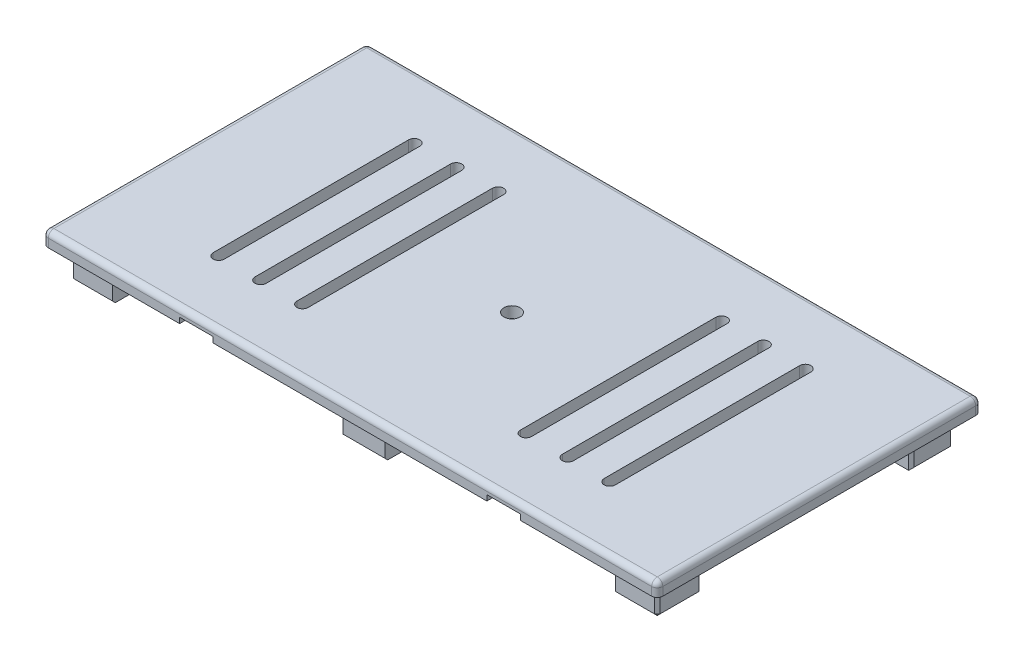
from build123d import *

# Parameters (mm, degrees)
SKETCH1_W           = 110
SKETCH1_H           = 58
BOSS_EXTRUDE1_DEPTH = 2.5
SKETCH2_W           = 105
SKETCH2_H           = 53
BOSS_EXTRUDE2_DEPTH = 1.5
SKETCH3_W           = 7.5
SKETCH3_H           = 3
BOSS_EXTRUDE3_DEPTH = 4
FILLET1_R           = 1
SKETCH4_W           = 6
SKETCH4_H           = 2.5
CUT_EXTRUDE1_DEPTH  = 1
FILLET2_R           = 1
CHAMFER1_SIZE       = 0.5
CUT_EXTRUDE2_DEPTH  = 125.611395948
FILLET3_R           = 1
SKETCH6_R           = 1.45
CUT_EXTRUDE3_DEPTH  = 125.611395948
SKETCH7_R           = 1.675
CUT_EXTRUDE4_DEPTH  = 2


with BuildPart() as part:
    # Sketch1 → Boss-Extrude1 (new body)
    with BuildSketch(Plane(origin=(0, 0, 0), x_dir=(1, 0, 0), z_dir=(0, 1, 0))):
        with Locations((55, 29)):
            Rectangle(SKETCH1_W, SKETCH1_H)
    extrude(amount=BOSS_EXTRUDE1_DEPTH)

    # Sketch2 → Boss-Extrude2 (add)
    with BuildSketch(Plane.XZ):
        with Locations((55, -29)):
            Rectangle(SKETCH2_W, SKETCH2_H)
    extrude(amount=BOSS_EXTRUDE2_DEPTH)

    # Sketch3 → Boss-Extrude3 (add)
    with BuildSketch(Plane.XZ.offset(1.5)):
        with Locations((55, -4)):
            Rectangle(SKETCH3_W, SKETCH3_H)
        Polygon((2.5, -2.5), (10, -2.5), (10, -5.5), (5.5, -5.5), (5.5, -10), (2.5, -10), align=None)
        Polygon((107.5, -2.5), (107.5, -10), (104.5, -10), (104.5, -5.5), (100, -5.5), (100, -2.5), align=None)
        Polygon((107.5, -55.5), (100, -55.5), (100, -52.5), (104.5, -52.5), (104.5, -48), (107.5, -48), align=None)
        with Locations((55, -54)):
            Rectangle(SKETCH3_W, SKETCH3_H)
        Polygon((2.5, -55.5), (2.5, -48), (5.5, -48), (5.5, -52.5), (10, -52.5), (10, -55.5), align=None)
    extrude(amount=BOSS_EXTRUDE3_DEPTH)

    # Fillet1
    fillet1_edges = [part.edges().sort_by_distance(p)[0] for p in [
        (104.5, -3.5, -52.5),
        (5.5, -3.5, -5.5),
        (104.5, -3.5, -5.5),
        (5.5, -3.5, -52.5),
    ]]
    fillet(fillet1_edges, radius=FILLET1_R)

    # Sketch4 → Cut-Extrude1 (cut)
    with BuildSketch(Plane.XZ):
        with Locations((27.5, -1.25)):
            Rectangle(SKETCH4_W, SKETCH4_H)
        with Locations((82.5, -1.25)):
            Rectangle(SKETCH4_W, SKETCH4_H)
        with Locations((82.5, -56.75)):
            Rectangle(SKETCH4_W, SKETCH4_H)
        with Locations((27.5, -56.75)):
            Rectangle(SKETCH4_W, SKETCH4_H)
    extrude(amount=-CUT_EXTRUDE1_DEPTH, mode=Mode.SUBTRACT)

    # Fillet2
    fillet2_edges = [part.edges().sort_by_distance(p)[0] for p in [
        (0, 1.25, -58),
        (110, 1.25, -58),
        (110, 1.25, 0),
        (0, 1.25, 0),
    ]]
    fillet(fillet2_edges, radius=FILLET2_R)

    # Chamfer1
    chamfer1_edges = [part.edges().sort_by_distance(p)[0] for p in [
        (2.5, -2.75, -2.5),
        (2.5, -2.75, -55.5),
        (107.5, -2.75, -55.5),
        (107.5, -2.75, -2.5),
        (107.5, -3.5, -48),
        (100, -3.5, -55.5),
        (107.5, -5.5, -51.75),
        (103.75, -5.5, -55.5),
        (2.5, -5.5, -6.25),
        (6.25, -5.5, -2.5),
        (55, -5.5, -2.5),
        (103.75, -5.5, -2.5),
        (107.5, -5.5, -6.25),
        (55, -5.5, -55.5),
        (6.25, -5.5, -55.5),
        (2.5, -5.5, -51.75),
    ]]
    chamfer(chamfer1_edges, length=CHAMFER1_SIZE)

    # Sketch5 → Cut-Extrude2 (cut, through all)
    with BuildSketch(Plane(origin=(0, 2.5, 0), x_dir=(1, 0, 0), z_dir=(0, 1, 0))):
        with BuildLine():
            Line((28.5, 46.5), (28.5, 11.5))
            ThreePointArc((28.5, 11.5), (27.5, 10.5), (26.5, 11.5))
            Line((26.5, 11.5), (26.5, 46.5))
            ThreePointArc((26.5, 46.5), (27.5, 47.5), (28.5, 46.5))
        make_face()
        with BuildLine():
            Line((34, 46.5), (34, 11.5))
            ThreePointArc((34, 11.5), (35, 10.5), (36, 11.5))
            Line((36, 11.5), (36, 46.5))
            ThreePointArc((36, 46.5), (35, 47.5), (34, 46.5))
        make_face()
        with BuildLine():
            Line((21, 46.5), (21, 11.5))
            ThreePointArc((21, 11.5), (20, 10.5), (19, 11.5))
            Line((19, 11.5), (19, 46.5))
            ThreePointArc((19, 46.5), (20, 47.5), (21, 46.5))
        make_face()
        with BuildLine():
            Line((89, 46.5), (89, 11.5))
            ThreePointArc((89, 11.5), (90, 10.5), (91, 11.5))
            Line((91, 11.5), (91, 46.5))
            ThreePointArc((91, 46.5), (90, 47.5), (89, 46.5))
        make_face()
        with BuildLine():
            Line((74, 46.5), (74, 11.5))
            ThreePointArc((74, 11.5), (75, 10.5), (76, 11.5))
            Line((76, 11.5), (76, 46.5))
            ThreePointArc((76, 46.5), (75, 47.5), (74, 46.5))
        make_face()
        with BuildLine():
            Line((81.5, 46.5), (81.5, 11.5))
            ThreePointArc((81.5, 11.5), (82.5, 10.5), (83.5, 11.5))
            Line((83.5, 11.5), (83.5, 46.5))
            ThreePointArc((83.5, 46.5), (82.5, 47.5), (81.5, 46.5))
        make_face()
    extrude(amount=-CUT_EXTRUDE2_DEPTH, mode=Mode.SUBTRACT)

    # Fillet3
    fillet3_edges = [part.edges().sort_by_distance(p)[0] for p in [
        (0, 2.5, -29),
        (55, 2.5, -58),
        (55, 2.5, 0),
        (110, 2.5, -29),
        (109.707106781, 2.5, -0.292893219),
        (109.707106781, 2.5, -57.707106781),
        (0.292893219, 2.5, -0.292893219),
        (0.292893219, 2.5, -57.707106781),
    ]]
    fillet(fillet3_edges, radius=FILLET3_R)

    # Sketch6 → Cut-Extrude3 (cut, through all)
    with BuildSketch(Plane(origin=(0, 2.5, 0), x_dir=(1, 0, 0), z_dir=(0, 1, 0))):
        with Locations(Location((55, 29, 0), (0, 0, 270))):
            Circle(SKETCH6_R)
    extrude(amount=-CUT_EXTRUDE3_DEPTH, mode=Mode.SUBTRACT)

    # Sketch7 → Cut-Extrude4 (cut)
    with BuildSketch(Plane.XZ.offset(1.5)):
        with Locations(Location((55, -29, 0), (0, 0, 270))):
            Circle(SKETCH7_R)
    extrude(amount=-CUT_EXTRUDE4_DEPTH, mode=Mode.SUBTRACT)


solid = part.part
